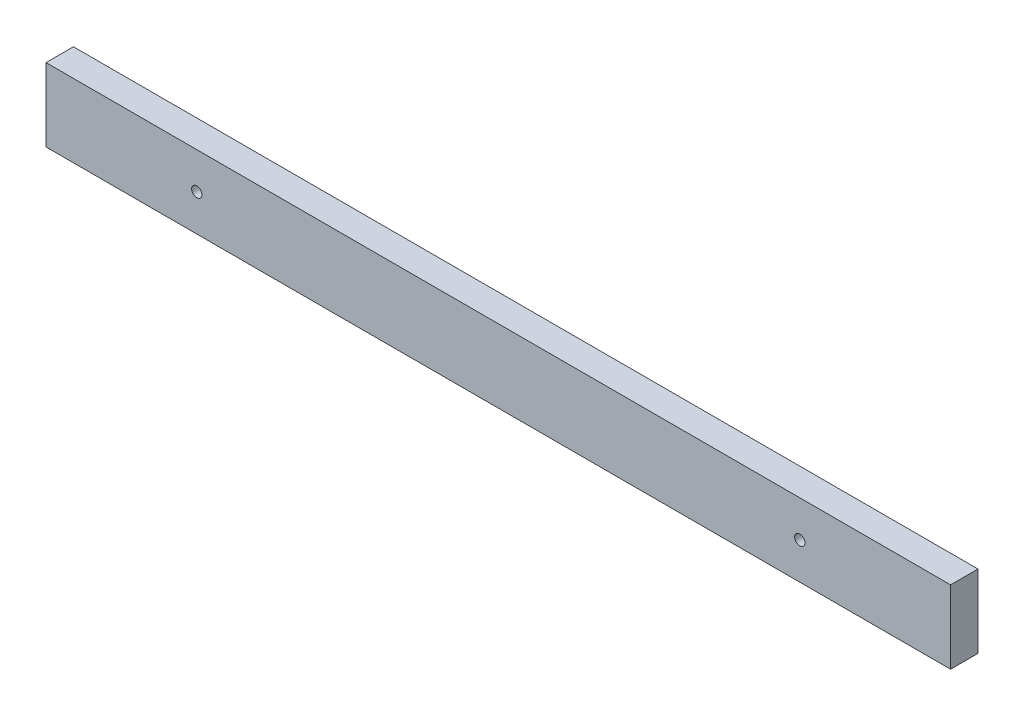
from build123d import *

# Parameters (mm, degrees)
SKETCH1_W           = 198
SKETCH1_H           = 6
BOSS_EXTRUDE1_DEPTH = 16
SKETCH2_R           = 1.125
CUT_EXTRUDE1_DEPTH  = 10


with BuildPart() as part:
    # Sketch1 → Boss-Extrude1 (new body)
    with BuildSketch(Plane(origin=(0, 0, 0), x_dir=(1, 0, 0), z_dir=(0, 1, 0))):
        Rectangle(SKETCH1_W, SKETCH1_H)
    extrude(amount=BOSS_EXTRUDE1_DEPTH)

    # Sketch2 → Cut-Extrude1 (cut)
    with BuildSketch(Plane.XY.offset(3)):
        with Locations((-66, 8)):
            Circle(SKETCH2_R)
        with Locations((66, 8)):
            Circle(SKETCH2_R)
    extrude(amount=-CUT_EXTRUDE1_DEPTH, mode=Mode.SUBTRACT)


solid = part.part
